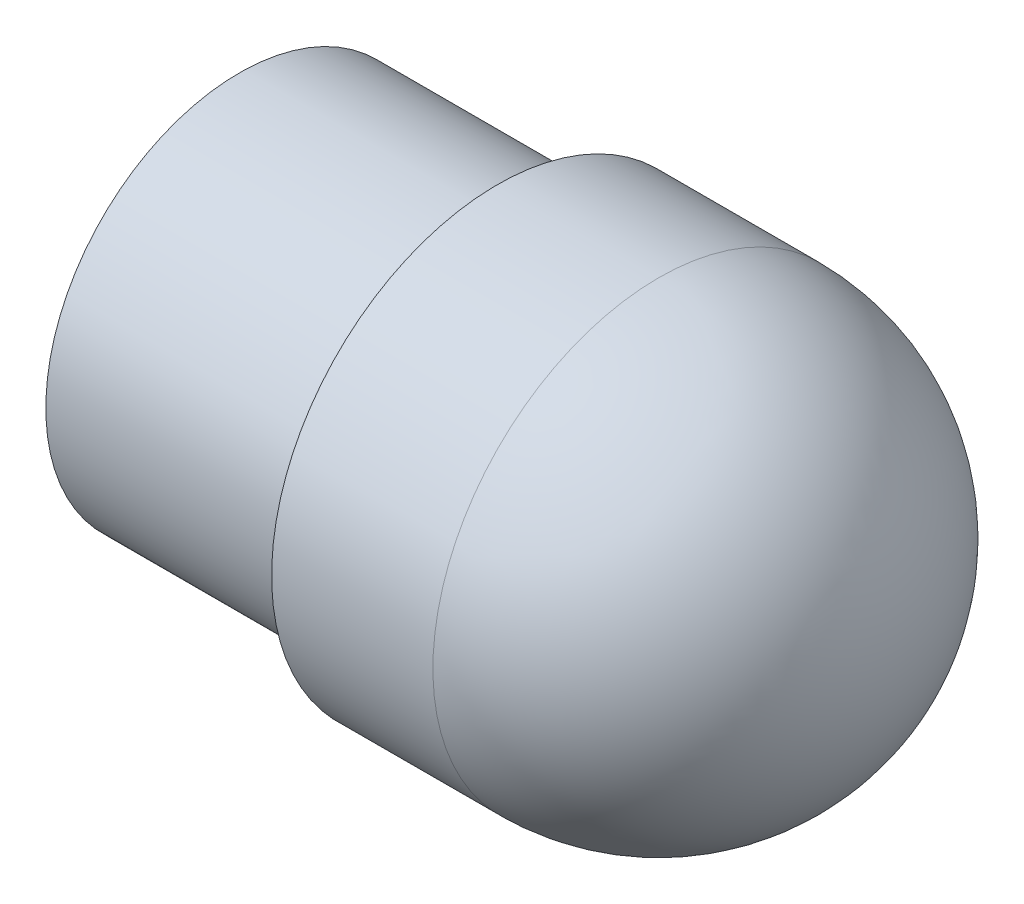
from build123d import *


with BuildPart() as part:
    # Croquis1 → Revolución1 (revolve)
    with BuildSketch(Plane.XY, mode=Mode.PRIVATE) as revoluci_n1_sk:
        with BuildLine():
            Line((0, 0), (-50, 0))
            Line((-50, 0), (-50, 15))
            Line((-50, 15), (-30, 15))
            Line((-30, 15), (-30, 17.5))
            Line((-30, 17.5), (-17.5, 17.5))
            ThreePointArc((-17.5, 17.5), (-5.125631329, 12.374368671), (0, 0))
        make_face()
    revolve(revoluci_n1_sk.sketch.rotate(Axis((0, 0, 0), (-1, 0, 0)), 90), axis=Axis((0, 0, 0), (-1, 0, 0)))


solid = part.part
